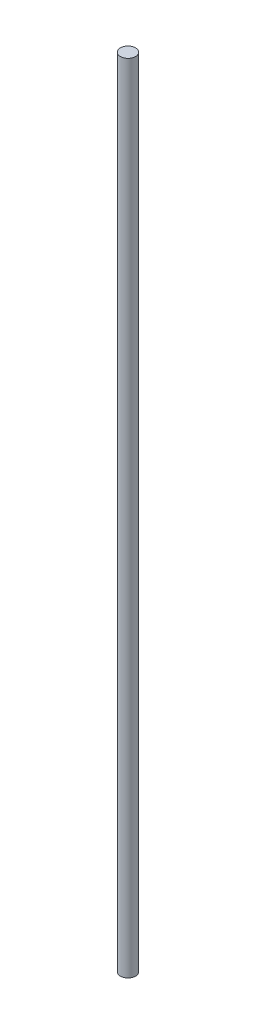
from build123d import *

# Parameters (mm, degrees)
SKETCH1_R           = 4.7625
BOSS_EXTRUDE1_DEPTH = 500


with BuildPart() as part:
    # Sketch1 → Boss-Extrude1 (new body)
    with BuildSketch(Plane(origin=(0, 0, 0), x_dir=(1, 0, 0), z_dir=(0, 1, 0))):
        with Locations(Location((0, 0, 0), (0, 0, 270))):
            Circle(SKETCH1_R)
    extrude(amount=BOSS_EXTRUDE1_DEPTH)


solid = part.part
